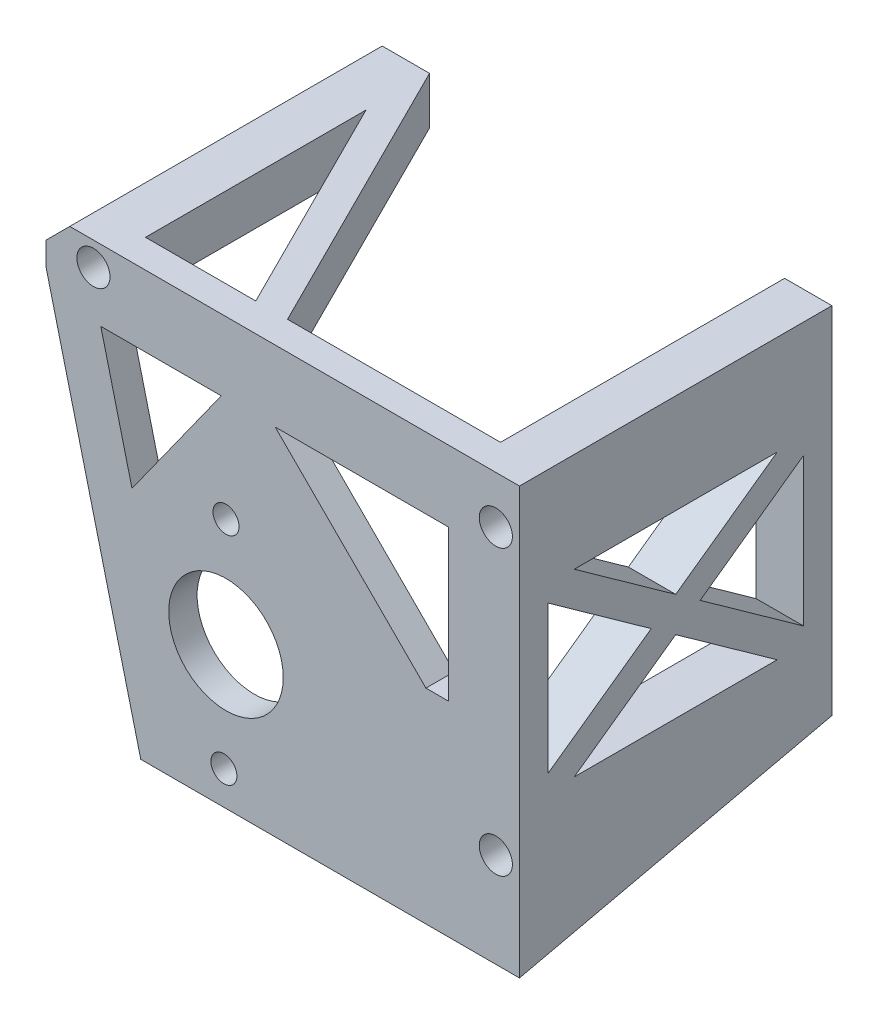
from build123d import *

# Parameters (mm, degrees)
SKETCH1_W               = 100
SKETCH1_H               = 90
BOSS_EXTRUDE1_DEPTH     = 6
CUT_EXTRUDE1_REACH      = 69.535
SKETCH2_R               = 12.1
SKETCH3_W               = 10
SKETCH3_H               = 90
BOSS_EXTRUDE2_DEPTH     = 60
SKETCH5_W               = 10
SKETCH5_H               = 10
BOSS_EXTRUDE4_DEPTH     = 60
SKETCH7_R               = 3.5
CUT_EXTRUDE2_DEPTH      = 35
CUT_EXTRUDE3_REACH      = 77.829
SKETCH8_R               = 1.6
CUT_EXTRUDE4_REACH      = 96.239
SKETCH9_R               = 1.6
SKETCH10_R              = 3.5
CUT_EXTRUDE5_DEPTH      = 35
M5_CLEARANCE_HOLE2_D    = 5.5
CUT_EXTRUDE7_REACH      = 127
CUT_EXTRUDE8_DEPTH      = 95.23905772
CUT_EXTRUDE8_DEPTH_BACK = 35
CHAMFER1_SIZE           = 5
CUT_EXTRUDE9_DEPTH      = 35
CUT_EXTRUDE10_REACH     = 127
BOSS_EXTRUDE5_DEPTH     = 10


with BuildPart() as part:
    # Sketch1 → Boss-Extrude1 (new body)
    with BuildSketch(Plane.XY):
        Rectangle(SKETCH1_W, SKETCH1_H)
    extrude(amount=BOSS_EXTRUDE1_DEPTH)

    # Sketch2 → Cut-Extrude1 (cut, up to next)
    with BuildSketch(Plane.XY.offset(6), mode=Mode.PRIVATE) as cut_extrude1_sk1:
        with Locations((-12, -15)):
            Circle(SKETCH2_R)
    cut_extrude1_tool1 = extrude(cut_extrude1_sk1.sketch, amount=-CUT_EXTRUDE1_REACH, mode=Mode.PRIVATE) & part.part
    add(cut_extrude1_tool1.solids().sort_by_distance((-12, -15, 6))[0], mode=Mode.SUBTRACT)

    # Sketch3 → Boss-Extrude2 (add)
    with BuildSketch(Plane(origin=(0, 0, 0), x_dir=(-1, 0, 0), z_dir=(0, 0, -1))):
        with Locations((-45, 0)):
            Rectangle(SKETCH3_W, SKETCH3_H)
    extrude(amount=BOSS_EXTRUDE2_DEPTH)

    # Sketch5 → Boss-Extrude4 (add)
    with BuildSketch(Plane(origin=(0, 0, 0), x_dir=(-1, 0, 0), z_dir=(0, 0, -1))):
        with Locations((40, 40)):
            Rectangle(SKETCH5_W, SKETCH5_H)
    extrude(amount=BOSS_EXTRUDE4_DEPTH)

    # Sketch7 → Cut-Extrude2 (cut)
    with BuildSketch(Plane.XY.offset(6)):
        with Locations((45, 35)):
            Circle(SKETCH7_R)
        with Locations((45, -25)):
            Circle(SKETCH7_R)
    extrude(amount=-CUT_EXTRUDE2_DEPTH, mode=Mode.SUBTRACT)

    # Sketch8 → Cut-Extrude3 (cut, up to next)
    with BuildSketch(Plane.XY.offset(-29), mode=Mode.PRIVATE) as cut_extrude3_sk1:
        with Locations((45, 35)):
            Circle(SKETCH8_R)
    cut_extrude3_tool1 = extrude(cut_extrude3_sk1.sketch, amount=-CUT_EXTRUDE3_REACH, mode=Mode.PRIVATE) & part.part
    # Sketch8 → Cut-Extrude3 (cut, up to next)
    with BuildSketch(Plane.XY.offset(-29), mode=Mode.PRIVATE) as cut_extrude3_sk2:
        with Locations((45, -25)):
            Circle(SKETCH8_R)
    cut_extrude3_tool2 = extrude(cut_extrude3_sk2.sketch, amount=-CUT_EXTRUDE3_REACH, mode=Mode.PRIVATE) & part.part
    add(cut_extrude3_tool1.solids().sort_by_distance((45, 35, -29))[0], mode=Mode.SUBTRACT)
    add(cut_extrude3_tool2.solids().sort_by_distance((45, -25, -29))[0], mode=Mode.SUBTRACT)

    # Sketch9 → Cut-Extrude4 (cut, up to next)
    with BuildSketch(Plane(origin=(0, 0, -60), x_dir=(-1, 0, 0), z_dir=(0, 0, -1)), mode=Mode.PRIVATE) as cut_extrude4_sk1:
        with Locations((40, 40)):
            Circle(SKETCH9_R)
    cut_extrude4_tool1 = extrude(cut_extrude4_sk1.sketch, amount=-CUT_EXTRUDE4_REACH, mode=Mode.PRIVATE) & part.part
    add(cut_extrude4_tool1.solids().sort_by_distance((-40, 40, -60))[0], mode=Mode.SUBTRACT)

    # Sketch10 → Cut-Extrude5 (cut)
    with BuildSketch(Plane.XY.offset(6)):
        with Locations((-40, 40)):
            Circle(SKETCH10_R)
    extrude(amount=-CUT_EXTRUDE5_DEPTH, mode=Mode.SUBTRACT)

    # M5 Clearance Hole2 (through all)
    with Locations(Plane.XY.offset(6)):
        with Locations((-11.992398496, 7.932190932), (-12.437514592, -37.928041631)):
            Hole(M5_CLEARANCE_HOLE2_D / 2)

    # Sketch16 → Cut-Extrude7 (cut, up to next)
    with BuildSketch(Plane(origin=(50, 0, 0), x_dir=(0, 0, -1), z_dir=(1, 0, 0)), mode=Mode.PRIVATE) as cut_extrude7_sk1:
        Polygon((0, 20.599003457), (0, -10.599003457), (21.83860484, 5), align=None)
    cut_extrude7_tool1 = extrude(cut_extrude7_sk1.sketch, amount=-CUT_EXTRUDE7_REACH, mode=Mode.PRIVATE) & part.part
    # Sketch16 → Cut-Extrude7 (cut, up to next)
    with BuildSketch(Plane(origin=(50, 0, 0), x_dir=(0, 0, -1), z_dir=(1, 0, 0)), mode=Mode.PRIVATE) as cut_extrude7_sk2:
        Polygon((54, -10.599003457), (32.16139516, 5), (54, 20.599003457), align=None)
    cut_extrude7_tool2 = extrude(cut_extrude7_sk2.sketch, amount=-CUT_EXTRUDE7_REACH, mode=Mode.PRIVATE) & part.part
    # Sketch16 → Cut-Extrude7 (cut, up to next)
    with BuildSketch(Plane(origin=(50, 0, 0), x_dir=(0, 0, -1), z_dir=(1, 0, 0)), mode=Mode.PRIVATE) as cut_extrude7_sk3:
        Polygon((27, 1.313289171), (5.56139516, -14), (48.43860484, -14), align=None)
    cut_extrude7_tool3 = extrude(cut_extrude7_sk3.sketch, amount=-CUT_EXTRUDE7_REACH, mode=Mode.PRIVATE) & part.part
    # Sketch16 → Cut-Extrude7 (cut, up to next)
    with BuildSketch(Plane(origin=(50, 0, 0), x_dir=(0, 0, -1), z_dir=(1, 0, 0)), mode=Mode.PRIVATE) as cut_extrude7_sk4:
        Polygon((27, 8.686710829), (48.43860484, 24), (5.56139516, 24), align=None)
    cut_extrude7_tool4 = extrude(cut_extrude7_sk4.sketch, amount=-CUT_EXTRUDE7_REACH, mode=Mode.PRIVATE) & part.part
    add(cut_extrude7_tool1.solids().sort_by_distance((50, 5, -7.279535))[0], mode=Mode.SUBTRACT)
    add(cut_extrude7_tool2.solids().sort_by_distance((50, 5, -46.720465))[0], mode=Mode.SUBTRACT)
    add(cut_extrude7_tool3.solids().sort_by_distance((50, -8.89557, -27))[0], mode=Mode.SUBTRACT)
    add(cut_extrude7_tool4.solids().sort_by_distance((50, 18.89557, -27))[0], mode=Mode.SUBTRACT)

    # Sketch17 → Cut-Extrude8 (cut, two sides: drawn at the far end of the back side and taken through both)
    with BuildSketch(Plane.XY.offset(6).offset(-CUT_EXTRUDE8_DEPTH_BACK)):
        Polygon((-114.544785815, 293.179143259), (-50, 35), (-30, -45), (34.544785815, -303.179143259), (-481.813500704, -432.268714889), (-630.903072333, 164.08957163), align=None)
    extrude(amount=CUT_EXTRUDE8_DEPTH + CUT_EXTRUDE8_DEPTH_BACK, mode=Mode.SUBTRACT)

    # Chamfer1
    chamfer1_edges = [part.edges().sort_by_distance(p)[0] for p in [
        (-50, 45, 3),
    ]]
    chamfer(chamfer1_edges, length=CHAMFER1_SIZE)

    # Sketch18 → Cut-Extrude9 (cut)
    with BuildSketch(Plane.XY.offset(6)):
        Polygon((-38.442235936, 30), (-31.851459244, 3.636893232), (-13.002338185, 30), align=None)
        Polygon((-1.606548225, 30), (30.238919993, -1.845468218), (35, -1.845468218), (35, 30), align=None)
    extrude(amount=-CUT_EXTRUDE9_DEPTH, mode=Mode.SUBTRACT)

    # Sketch19 → Cut-Extrude10 (cut, up to next)
    with BuildSketch(Plane(origin=(50, 0, 0), x_dir=(0, 0, -1), z_dir=(1, 0, 0)), mode=Mode.PRIVATE) as cut_extrude10_sk1:
        Polygon((60, -30), (-6, -45), (60, -45), align=None)
    cut_extrude10_tool1 = extrude(cut_extrude10_sk1.sketch, amount=-CUT_EXTRUDE10_REACH, mode=Mode.PRIVATE) & part.part
    add(cut_extrude10_tool1.solids().sort_by_distance((50, -40, -38))[0], mode=Mode.SUBTRACT)

    # Sketch20 → Boss-Extrude5 (add)
    with BuildSketch(Plane(origin=(0, 45, 0), x_dir=(1, 0, 0), z_dir=(0, 1, 0))):
        Polygon((-5, 0), (-35, 60), (-35, 46.583592135), (-11.708203932, 0), align=None)
    extrude(amount=-BOSS_EXTRUDE5_DEPTH)


solid = part.part
